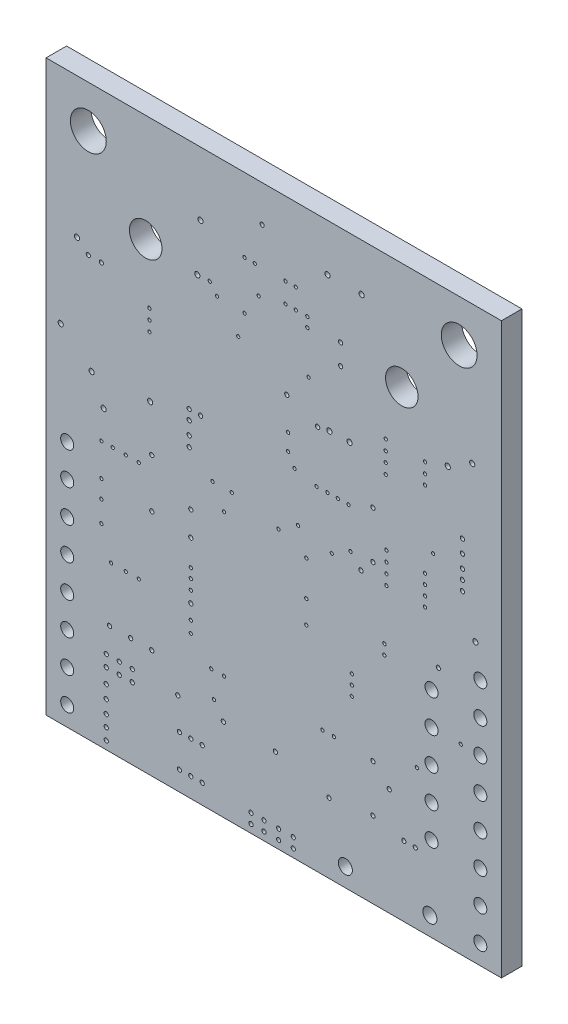
from build123d import *

# Parameters (mm, degrees)
SKETCH1_W           = 35.56
SKETCH1_H           = 44.45
BOARD_OUTLINE_DEPTH = 1.6
SKETCH2_R           = 0.127
SKETCH2_R_2         = 0.2032
SKETCH2_R_3         = 0.1651
NPTH_DEPTH          = 57.946256242
SKETCH3_R           = 1.4
SKETCH3_R_2         = 0.51
SKETCH3_R_3         = 1.27
SKETCH3_R_4         = 0.55
PTH_DEPTH           = 57.946256242


with BuildPart() as part:
    # Sketch1 → Board_Outline (new body)
    with BuildSketch(Plane.XY):
        with Locations((17.78, 22.225)):
            Rectangle(SKETCH1_W, SKETCH1_H)
    extrude(amount=BOARD_OUTLINE_DEPTH)

    # Sketch2 → NPTH (cut, through all)
    with BuildSketch(Plane.XY):
        with Locations((29.591, 23.622)):
            Circle(SKETCH2_R)
        with Locations((32.385, 14.224)):
            Circle(SKETCH2_R)
        with Locations((20.32, 18.034)):
            Circle(SKETCH2_R)
        with Locations((13.111, 7.6)):
            Circle(SKETCH2_R)
        with Locations((18.7, 37.15)):
            Circle(SKETCH2_R)
        with Locations((19.676, 22.67)):
            Circle(SKETCH2_R)
        with Locations((16.3, 38.7)):
            Circle(SKETCH2_R)
        with Locations((18.149, 21.651)):
            Circle(SKETCH2_R)
        with Locations((18.7, 38.7)):
            Circle(SKETCH2_R)
        with Locations((20.322, 20.778)):
            Circle(SKETCH2_R)
        with Locations((12.78, 35.731)):
            Circle(SKETCH2_R)
        with Locations((19.5, 37.15)):
            Circle(SKETCH2_R)
        with Locations((13, 22.3)):
            Circle(SKETCH2_R)
        with Locations((13.35, 35)):
            Circle(SKETCH2_R)
        with Locations((20.4, 37.15)):
            Circle(SKETCH2_R)
        with Locations((18.9, 28.573)):
            Circle(SKETCH2_R)
        with Locations((15.5, 38.7)):
            Circle(SKETCH2_R)
        with Locations((14.5, 22.3)):
            Circle(SKETCH2_R)
        with Locations((19.5, 38.7)):
            Circle(SKETCH2_R)
        with Locations((13.9, 20.7)):
            Circle(SKETCH2_R)
        with Locations((15.5, 34.925)):
            Circle(SKETCH2_R)
        with Locations((12.899, 9.58)):
            Circle(SKETCH2_R)
        with Locations((16.6, 36.65)):
            Circle(SKETCH2_R)
        with Locations((13.899, 9.58)):
            Circle(SKETCH2_R)
        with Locations((20.4, 36.4)):
            Circle(SKETCH2_R)
        with Locations((18.9, 27.273)):
            Circle(SKETCH2_R)
        with Locations((22.311, 22.097)):
            Circle(SKETCH2_R)
        with Locations((20.5, 33.1)):
            Circle(SKETCH2_R)
        with Locations((19.399, 26.384)):
            Circle(SKETCH2_R)
        with Locations((4.318, 20.701)):
            Circle(SKETCH2_R)
        with Locations((4.318, 16.764)):
            Circle(SKETCH2_R)
        with Locations((5.08, 12.827)):
            Circle(SKETCH2_R)
        with Locations((31.369, 32.512)):
            Circle(SKETCH2_R_2)
        with Locations((8.255, 21.717)):
            Circle(SKETCH2_R_3)
        with Locations((5.207, 20.701)):
            Circle(SKETCH2_R)
        with Locations((7.239, 12.827)):
            Circle(SKETCH2_R)
        with Locations((30.634, 18.515)):
            Circle(SKETCH2_R_3)
        with Locations((24.592, 22.079)):
            Circle(SKETCH2_R_3)
        with Locations((33.528, 21.717)):
            Circle(SKETCH2_R_2)
        with Locations((4.318, 18.161)):
            Circle(SKETCH2_R)
        with Locations((4.318, 15.113)):
            Circle(SKETCH2_R)
        with Locations((17.018, 0.635)):
            Circle(SKETCH2_R_3)
        with Locations((16.002, 0.635)):
            Circle(SKETCH2_R_3)
        with Locations((32.512, 24.638)):
            Circle(SKETCH2_R_3)
        with Locations((32.512, 25.4)):
            Circle(SKETCH2_R_3)
        with Locations((28.829, 5.461)):
            Circle(SKETCH2_R_3)
        with Locations((27.94, 5.461)):
            Circle(SKETCH2_R_3)
        with Locations((16.002, 1.397)):
            Circle(SKETCH2_R_3)
        with Locations((17.018, 1.397)):
            Circle(SKETCH2_R_3)
        with Locations((4.699, 0.635)):
            Circle(SKETCH2_R_3)
        with Locations((4.699, 1.524)):
            Circle(SKETCH2_R_3)
        with Locations((4.699, 2.413)):
            Circle(SKETCH2_R_3)
        with Locations((6.223, 12.827)):
            Circle(SKETCH2_R)
        with Locations((7.239, 20.701)):
            Circle(SKETCH2_R)
        with Locations((11.303, 17.653)):
            Circle(SKETCH2_R_3)
        with Locations((6.223, 20.701)):
            Circle(SKETCH2_R)
        with Locations((11.176, 26.289)):
            Circle(SKETCH2_R_3)
        with Locations((12.065, 26.289)):
            Circle(SKETCH2_R_3)
        with Locations((6.604, 8.509)):
            Circle(SKETCH2_R_3)
        with Locations((8.255, 8.509)):
            Circle(SKETCH2_R_3)
        with Locations((10.287, 6.477)):
            Circle(SKETCH2_R_3)
        with Locations((17.907, 6.477)):
            Circle(SKETCH2_R_3)
        with Locations((1.143, 27.051)):
            Circle(SKETCH2_R_2)
        with Locations((4.4958, 22.987)):
            Circle(SKETCH2_R_2)
        with Locations((25.527, 26.797)):
            Circle(SKETCH2_R_3)
        with Locations((25.527, 5.969)):
            Circle(SKETCH2_R_3)
        with Locations((32.512, 26.162)):
            Circle(SKETCH2_R_3)
        with Locations((12.192, 4.064)):
            Circle(SKETCH2_R_3)
        with Locations((12.192, 1.524)):
            Circle(SKETCH2_R_3)
        with Locations((10.414, 1.524)):
            Circle(SKETCH2_R_3)
        with Locations((10.414, 4.064)):
            Circle(SKETCH2_R_3)
        with Locations((11.303, 4.064)):
            Circle(SKETCH2_R_3)
        with Locations((11.303, 1.524)):
            Circle(SKETCH2_R_3)
        with Locations((16.873, 41.6)):
            Circle(SKETCH2_R_3)
        with Locations((23, 35.1)):
            Circle(SKETCH2_R_3)
        with Locations((22.127, 30.273)):
            Circle(SKETCH2_R_2)
        with Locations((18.8, 31.0635)):
            Circle(SKETCH2_R_3)
        with Locations((11.303, 13.208)):
            Circle(SKETCH2_R_3)
        with Locations((26.5746, 23.641)):
            Circle(SKETCH2_R)
        with Locations((21.209, 30.099)):
            Circle(SKETCH2_R_3)
        with Locations((11.176, 25.527)):
            Circle(SKETCH2_R_3)
        with Locations((24.638, 40.767)):
            Circle(SKETCH2_R_2)
        with Locations((11.811, 35.687)):
            Circle(SKETCH2_R_2)
        with Locations((21.59, 9.779)):
            Circle(SKETCH2_R)
        with Locations((22.479, 9.779)):
            Circle(SKETCH2_R)
        with Locations((11.303, 14.097)):
            Circle(SKETCH2_R)
        with Locations((8.071, 29.953)):
            Circle(SKETCH2_R)
        with Locations((11.303, 14.883)):
            Circle(SKETCH2_R)
        with Locations((8.071, 30.753)):
            Circle(SKETCH2_R)
        with Locations((11.303, 15.621)):
            Circle(SKETCH2_R)
        with Locations((8.071, 31.553)):
            Circle(SKETCH2_R)
        with Locations((23, 36.7)):
            Circle(SKETCH2_R_3)
        with Locations((3.556, 25.019)):
            Circle(SKETCH2_R_2)
        with Locations((2.413, 33.528)):
            Circle(SKETCH2_R_2)
        with Locations((20.32, 16.256)):
            Circle(SKETCH2_R)
        with Locations((29.591, 24.384)):
            Circle(SKETCH2_R)
        with Locations((19.304, 0.635)):
            Circle(SKETCH2_R_3)
        with Locations((19.304, 1.397)):
            Circle(SKETCH2_R_3)
        with Locations((18.161, 1.397)):
            Circle(SKETCH2_R_3)
        with Locations((18.161, 0.635)):
            Circle(SKETCH2_R_3)
        with Locations((30.226, 26.035)):
            Circle(SKETCH2_R)
        with Locations((21.117, 26.019)):
            Circle(SKETCH2_R)
        with Locations((29.591, 22.86)):
            Circle(SKETCH2_R)
        with Locations((26.416, 17.272)):
            Circle(SKETCH2_R)
        with Locations((29.591, 22.098)):
            Circle(SKETCH2_R)
        with Locations((26.416, 18.034)):
            Circle(SKETCH2_R)
        with Locations((22.7838, 26.035)):
            Circle(SKETCH2_R)
        with Locations((29.591, 31.115)):
            Circle(SKETCH2_R)
        with Locations((21.971, 26.035)):
            Circle(SKETCH2_R)
        with Locations((29.591, 30.353)):
            Circle(SKETCH2_R)
        with Locations((29.591, 31.9278)):
            Circle(SKETCH2_R)
        with Locations((23.622, 26.035)):
            Circle(SKETCH2_R)
        with Locations((11.303, 11.176)):
            Circle(SKETCH2_R)
        with Locations((11.303, 12.065)):
            Circle(SKETCH2_R)
        with Locations((23.78, 22.956)):
            Circle(SKETCH2_R)
        with Locations((23.876, 13.208)):
            Circle(SKETCH2_R)
        with Locations((23.876, 13.97)):
            Circle(SKETCH2_R)
        with Locations((28.956, 10.922)):
            Circle(SKETCH2_R)
        with Locations((23.876, 14.732)):
            Circle(SKETCH2_R)
        with Locations((22.098, 5.461)):
            Circle(SKETCH2_R_3)
        with Locations((26.797, 8.382)):
            Circle(SKETCH2_R_3)
        with Locations((11.303, 19.558)):
            Circle(SKETCH2_R_3)
        with Locations((25.527, 23.114)):
            Circle(SKETCH2_R_3)
        with Locations((32.512, 27.178)):
            Circle(SKETCH2_R_3)
        with Locations((32.512, 28.194)):
            Circle(SKETCH2_R_3)
        with Locations((5.715, 6.477)):
            Circle(SKETCH2_R_3)
        with Locations((4.699, 6.477)):
            Circle(SKETCH2_R_3)
        with Locations((6.731, 6.477)):
            Circle(SKETCH2_R_3)
        with Locations((11.176, 24.511)):
            Circle(SKETCH2_R_3)
        with Locations((8.255, 17.907)):
            Circle(SKETCH2_R_3)
        with Locations((4.318, 32.766)):
            Circle(SKETCH2_R_3)
        with Locations((11.176, 23.711)):
            Circle(SKETCH2_R_3)
        with Locations((6.731, 5.588)):
            Circle(SKETCH2_R_3)
        with Locations((5.715, 5.588)):
            Circle(SKETCH2_R_3)
        with Locations((4.953, 8.509)):
            Circle(SKETCH2_R_3)
        with Locations((13.843, 6.477)):
            Circle(SKETCH2_R_3)
        with Locations((25.527, 9.652)):
            Circle(SKETCH2_R_3)
        with Locations((4.699, 3.429)):
            Circle(SKETCH2_R_3)
        with Locations((4.699, 4.445)):
            Circle(SKETCH2_R_3)
        with Locations((4.699, 5.588)):
            Circle(SKETCH2_R_3)
        with Locations((3.302, 32.766)):
            Circle(SKETCH2_R_3)
        with Locations((15, 33.1)):
            Circle(SKETCH2_R)
        with Locations((26.5746, 22.041)):
            Circle(SKETCH2_R)
        with Locations((26.5746, 22.841)):
            Circle(SKETCH2_R)
        with Locations((26.5746, 24.441)):
            Circle(SKETCH2_R)
        with Locations((26.524, 31.934)):
            Circle(SKETCH2_R)
        with Locations((26.524, 31.134)):
            Circle(SKETCH2_R)
        with Locations((26.524, 30.334)):
            Circle(SKETCH2_R)
        with Locations((26.524, 29.534)):
            Circle(SKETCH2_R)
        with Locations((33.274, 33.655)):
            Circle(SKETCH2_R_2)
        with Locations((23.7, 30.304)):
            Circle(SKETCH2_R_2)
        with Locations((21.971, 40.767)):
            Circle(SKETCH2_R_2)
        with Locations((8.128, 25.273)):
            Circle(SKETCH2_R_2)
        with Locations((12.065, 39.497)):
            Circle(SKETCH2_R_2)
    extrude(amount=NPTH_DEPTH, mode=Mode.SUBTRACT)

    # Sketch3 → PTH (cut, through all)
    with BuildSketch(Plane.XY):
        with Locations((3.3, 41.15)):
            Circle(SKETCH3_R)
        with Locations((32.26, 41.15)):
            Circle(SKETCH3_R)
        with Locations((33.91, 19.3)):
            Circle(SKETCH3_R_2)
        with Locations((33.91, 16.76)):
            Circle(SKETCH3_R_2)
        with Locations((33.91, 14.22)):
            Circle(SKETCH3_R_2)
        with Locations((33.91, 11.68)):
            Circle(SKETCH3_R_2)
        with Locations((33.91, 9.14)):
            Circle(SKETCH3_R_2)
        with Locations((33.91, 6.6)):
            Circle(SKETCH3_R_2)
        with Locations((33.91, 4.06)):
            Circle(SKETCH3_R_2)
        with Locations((33.91, 1.52)):
            Circle(SKETCH3_R_2)
        with Locations((1.65, 19.3)):
            Circle(SKETCH3_R_2)
        with Locations((1.65, 16.76)):
            Circle(SKETCH3_R_2)
        with Locations((1.65, 14.22)):
            Circle(SKETCH3_R_2)
        with Locations((1.65, 11.68)):
            Circle(SKETCH3_R_2)
        with Locations((1.65, 9.14)):
            Circle(SKETCH3_R_2)
        with Locations((1.65, 6.6)):
            Circle(SKETCH3_R_2)
        with Locations((1.65, 4.06)):
            Circle(SKETCH3_R_2)
        with Locations((1.65, 1.52)):
            Circle(SKETCH3_R_2)
        with Locations((30.1, 16.76)):
            Circle(SKETCH3_R_2)
        with Locations((30.1, 14.22)):
            Circle(SKETCH3_R_2)
        with Locations((30.1, 11.68)):
            Circle(SKETCH3_R_2)
        with Locations((30.1, 9.14)):
            Circle(SKETCH3_R_2)
        with Locations((30.1, 6.6)):
            Circle(SKETCH3_R_2)
        with Locations((7.78, 36.07)):
            Circle(SKETCH3_R_3)
        with Locations((27.78, 36.07)):
            Circle(SKETCH3_R_3)
        with Locations((23.37, 1.45)):
            Circle(SKETCH3_R_4)
        with Locations((29.97, 1.45)):
            Circle(SKETCH3_R_4)
    extrude(amount=PTH_DEPTH, mode=Mode.SUBTRACT)


solid = part.part
